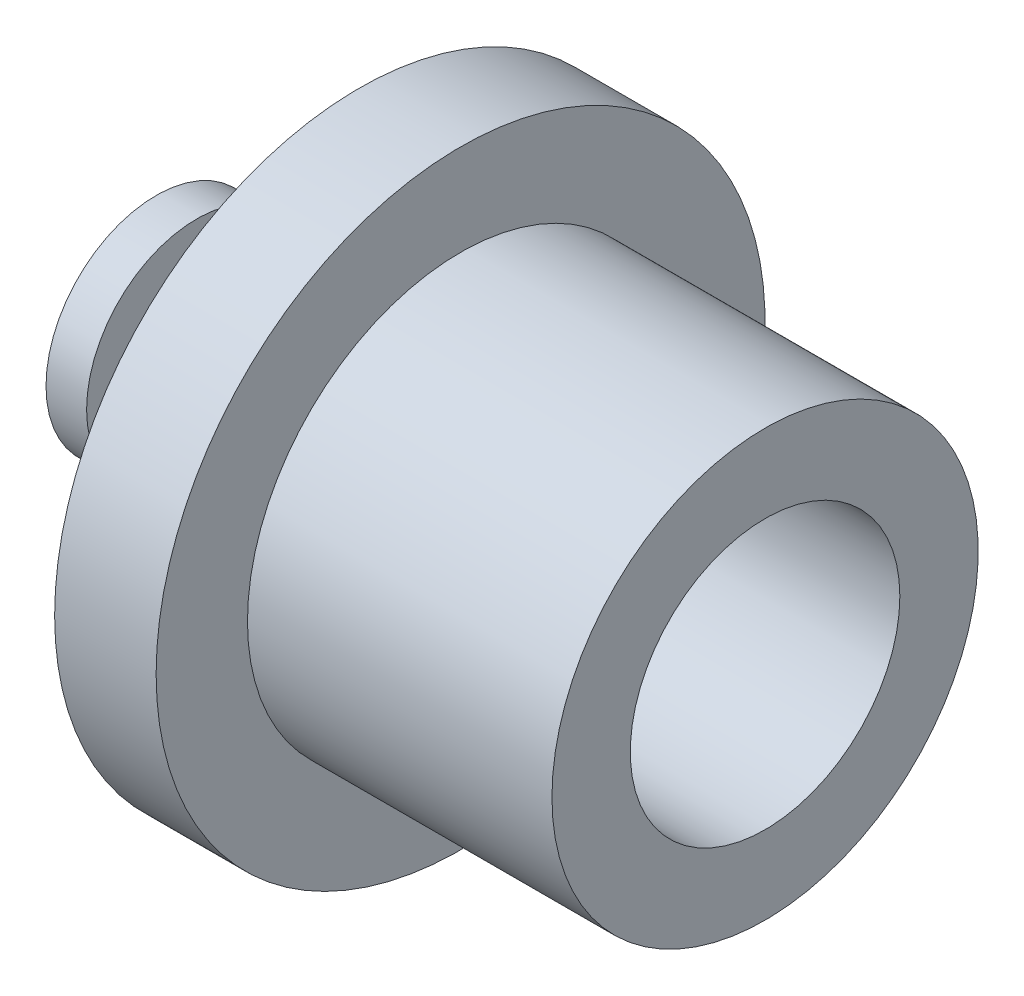
from build123d import *

# Parameters (mm, degrees)
PIPE_TAP_DRILL_FOR_1_8_TAP1_D     = 8.4328
PIPE_TAP_DRILL_FOR_1_8_TAP1_DEPTH = 9.525
PIPE_TAP_DRILL_FOR_1_8_TAP1_TIP   = 2.533468714
F_3_32_0_09375_DIAMETER_HOLE2_D   = 2.38125


with BuildPart() as part:
    # Sketch1 → Revolve1 (revolve)
    with BuildSketch(Plane.XY, mode=Mode.PRIVATE) as revolve1_sk:
        Polygon((6.35, 3.444875), (6.35, 9.525), (9.525, 9.525), (9.525, 6.6675), (19.05, 6.6675), (19.05, 0), (0, 0), (0, 3.444875), (1.27, 3.444875), (1.27, 2.073275), (3.81, 2.073275), (3.81, 3.444875), align=None)
    revolve(revolve1_sk.sketch.rotate(Axis((0, 0, 0), (1, 0, 0)), 90), axis=Axis((0, 0, 0), (1, 0, 0)))

    # Pipe Tap Drill for 1/8 Tap1
    with Locations(Plane(origin=(19.05, 0, 0), x_dir=(0, 0, -1), z_dir=(1, 0, 0))):
        with Locations((0, 0)):
            Hole(PIPE_TAP_DRILL_FOR_1_8_TAP1_D / 2, depth=PIPE_TAP_DRILL_FOR_1_8_TAP1_DEPTH)
            with Locations((0, 0, -(PIPE_TAP_DRILL_FOR_1_8_TAP1_DEPTH + PIPE_TAP_DRILL_FOR_1_8_TAP1_TIP / 2))):  # 118° drill point
                Cone(0, PIPE_TAP_DRILL_FOR_1_8_TAP1_D / 2, PIPE_TAP_DRILL_FOR_1_8_TAP1_TIP, mode=Mode.SUBTRACT)

    # 3/32 (0.09375) Diameter Hole2 (through all)
    with Locations(Plane.ZY):
        with Locations((0, 0)):
            Hole(F_3_32_0_09375_DIAMETER_HOLE2_D / 2)


solid = part.part
